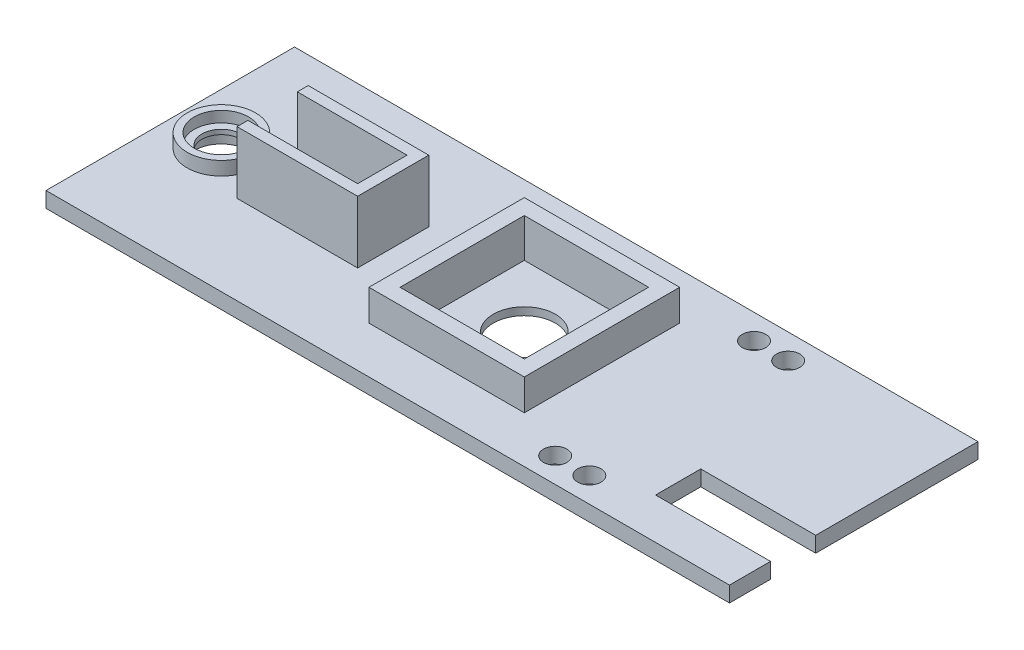
from build123d import *

# Parameters (mm, degrees)
SKETCH1_W            = 279.4
SKETCH1_H            = 101.6
BOSS_EXTRUDE1_DEPTH  = 6.35
SKETCH2_R            = 13.97
BOSS_EXTRUDE3_DEPTH  = 5.55625
SKETCH9_R            = 11.1125
CUT_EXTRUDE4_DEPTH   = 4.445
CUT_EXTRUDE5_START   = -5.55625
SKETCH10_R           = 11.1125
CUT_EXTRUDE5_DEPTH   = 5.55625
SKETCH11_R           = 7.9375
CUT_EXTRUDE6_DEPTH   = 285.078633923
SKETCH12_R           = 12.7
CUT_EXTRUDE7_DEPTH   = 285.051619429
SKETCH22_W           = 63.5
SKETCH22_H           = 63.5
BOSS_EXTRUDE7_DEPTH  = 12.7
SKETCH25_W           = 50.8
SKETCH25_H           = 50.8
CUT_EXTRUDE11_DEPTH  = 15.875
SKETCH32_R           = 4.7625
CUT_EXTRUDE12_DEPTH  = 6.35
SKETCH38_W           = 46.99
SKETCH38_H           = 18.470251096
CUT_EXTRUDE13_DEPTH  = 6.35
SKETCH50_W           = 49.2899954
SKETCH50_H           = 29.09000024
BOSS_EXTRUDE14_DEPTH = 25.4
SKETCH49_W           = 40.3999954
SKETCH49_H           = 20.20000024
CUT_EXTRUDE19_DEPTH  = 286.114292872
SKETCH52_W           = 20.20000024
SKETCH52_H           = 25.4
CUT_EXTRUDE20_DEPTH  = 4.445
SKETCH53_W           = 44.8449954
SKETCH53_H           = 20.20000024
BOSS_EXTRUDE15_DEPTH = 4.760622178
SKETCH55_W           = 44.8449954
SKETCH55_H           = 20.20000024
CUT_EXTRUDE21_DEPTH  = 285.729668136
SKETCH56_W           = 13.97
SKETCH56_H           = 20.20000024
BOSS_EXTRUDE16_DEPTH = 6.35


with BuildPart() as part:
    # Sketch1 → Boss-Extrude1 (new body)
    with BuildSketch(Plane(origin=(0, 0, 0), x_dir=(1, 0, 0), z_dir=(0, 1, 0))):
        with Locations((-139.7, 0)):
            Rectangle(SKETCH1_W, SKETCH1_H)
    extrude(amount=BOSS_EXTRUDE1_DEPTH)

    # Sketch2 → Boss-Extrude3 (add)
    with BuildSketch(Plane(origin=(0, 6.35, 0), x_dir=(1, 0, 0), z_dir=(0, 1, 0))):
        with Locations(Location((-258.510557857, 0, 0), (0, 0, 90))):
            Circle(SKETCH2_R)
    extrude(amount=BOSS_EXTRUDE3_DEPTH)

    # Sketch9 → Cut-Extrude4 (cut)
    with BuildSketch(Plane(origin=(0, 11.90625, 0), x_dir=(1, 0, 0), z_dir=(0, 1, 0))):
        with Locations(Location((-258.510557857, 0, 0), (0, 0, 270))):
            Circle(SKETCH9_R)
    extrude(amount=-CUT_EXTRUDE4_DEPTH, mode=Mode.SUBTRACT)

    # Sketch10 → Cut-Extrude5 (cut)
    with BuildSketch(Plane(origin=(0, 0, 0), x_dir=(-1, 0, 0), z_dir=(0, -1, 0)).offset(CUT_EXTRUDE5_START)):
        with Locations(Location((258.510557857, 0, 0), (0, 0, 270))):
            Circle(SKETCH10_R)
    extrude(amount=CUT_EXTRUDE5_DEPTH, mode=Mode.SUBTRACT)

    # Sketch11 → Cut-Extrude6 (cut, through all)
    with BuildSketch(Plane(origin=(0, 7.46125, 0), x_dir=(1, 0, 0), z_dir=(0, 1, 0))):
        with Locations(Location((-258.510557857, 0, 0), (0, 0, 270))):
            Circle(SKETCH11_R)
    extrude(amount=-CUT_EXTRUDE6_DEPTH, mode=Mode.SUBTRACT)

    # Sketch12 → Cut-Extrude7 (cut, through all)
    with BuildSketch(Plane(origin=(0, 6.35, 0), x_dir=(1, 0, 0), z_dir=(0, 1, 0))):
        with Locations(Location((-134.666203771, 0, 0), (0, 0, 270))):
            Circle(SKETCH12_R)
    extrude(amount=-CUT_EXTRUDE7_DEPTH, mode=Mode.SUBTRACT)

    # Sketch22 → Boss-Extrude7 (add)
    with BuildSketch(Plane(origin=(0, 6.35, 0), x_dir=(1, 0, 0), z_dir=(0, 1, 0))):
        with Locations((-134.666203771, 0)):
            Rectangle(SKETCH22_W, SKETCH22_H)
    extrude(amount=BOSS_EXTRUDE7_DEPTH)

    # Sketch25 → Cut-Extrude11 (cut)
    with BuildSketch(Plane(origin=(0, 19.05, 0), x_dir=(1, 0, 0), z_dir=(0, 1, 0))):
        with Locations((-134.666203771, 0)):
            Rectangle(SKETCH25_W, SKETCH25_H)
    extrude(amount=-CUT_EXTRUDE11_DEPTH, mode=Mode.SUBTRACT)

    # Sketch32 → Cut-Extrude12 (cut)
    with BuildSketch(Plane(origin=(0, 6.35, 0), x_dir=(1, 0, 0), z_dir=(0, 1, 0))):
        with Locations(Location((-67.44195898, -40.64, 0), (0, 0, 270))):
            Circle(SKETCH32_R)
        with Locations(Location((-81.41195898, -40.64, 0), (0, 0, 270))):
            Circle(SKETCH32_R)
        with Locations(Location((-67.44195898, 40.64, 0), (0, 0, 270))):
            Circle(SKETCH32_R)
        with Locations(Location((-81.41195898, 40.64, 0), (0, 0, 270))):
            Circle(SKETCH32_R)
    extrude(amount=-CUT_EXTRUDE12_DEPTH, mode=Mode.SUBTRACT)

    # Sketch38 → Cut-Extrude13 (cut)
    with BuildSketch(Plane(origin=(0, 6.35, 0), x_dir=(1, 0, 0), z_dir=(0, 1, 0))):
        with Locations((-23.495, -24.777709652)):
            Rectangle(SKETCH38_W, SKETCH38_H)
    extrude(amount=-CUT_EXTRUDE13_DEPTH, mode=Mode.SUBTRACT)

    # Sketch50 → Boss-Extrude14 (add)
    with BuildSketch(Plane(origin=(0, 6.35, 0), x_dir=(1, 0, 0), z_dir=(0, 1, 0))):
        with Locations((-212.910560157, 0)):
            Rectangle(SKETCH50_W, SKETCH50_H)
    extrude(amount=BOSS_EXTRUDE14_DEPTH)

    # Sketch49 → Cut-Extrude19 (cut, through all)
    with BuildSketch(Plane(origin=(0, 6.35, 0), x_dir=(1, 0, 0), z_dir=(0, 1, 0))):
        with Locations((-212.910560157, 0)):
            Rectangle(SKETCH49_W, SKETCH49_H)
    extrude(amount=CUT_EXTRUDE19_DEPTH, mode=Mode.SUBTRACT)

    # Sketch52 → Cut-Extrude20 (cut)
    with BuildSketch(Plane(origin=(-233.110557857, 0, 0), x_dir=(0, 0, -1), z_dir=(1, 0, 0))):
        with Locations((0, 19.05)):
            Rectangle(SKETCH52_W, SKETCH52_H)
    extrude(amount=-CUT_EXTRUDE20_DEPTH, mode=Mode.SUBTRACT)

    # Sketch53 → Boss-Extrude15 (add)
    with BuildSketch(Plane(origin=(0, 6.35, 0), x_dir=(1, 0, 0), z_dir=(0, 1, 0))):
        with Locations((-215.133060157, 0)):
            Rectangle(SKETCH53_W, SKETCH53_H)
    extrude(amount=BOSS_EXTRUDE15_DEPTH)

    # Sketch55 → Cut-Extrude21 (cut, through all)
    with BuildSketch(Plane(origin=(0, 11.110622178, 0), x_dir=(1, 0, 0), z_dir=(0, 1, 0))):
        with Locations((-215.133060157, 0)):
            Rectangle(SKETCH55_W, SKETCH55_H)
    extrude(amount=-CUT_EXTRUDE21_DEPTH, mode=Mode.SUBTRACT)

    # Sketch56 → Boss-Extrude16 (add)
    with BuildSketch(Plane(origin=(0, 6.35, 0), x_dir=(1, 0, 0), z_dir=(0, 1, 0))):
        with Locations((-214.060557857, 0)):
            Rectangle(SKETCH56_W, SKETCH56_H)
    extrude(amount=-BOSS_EXTRUDE16_DEPTH)


solid = part.part
